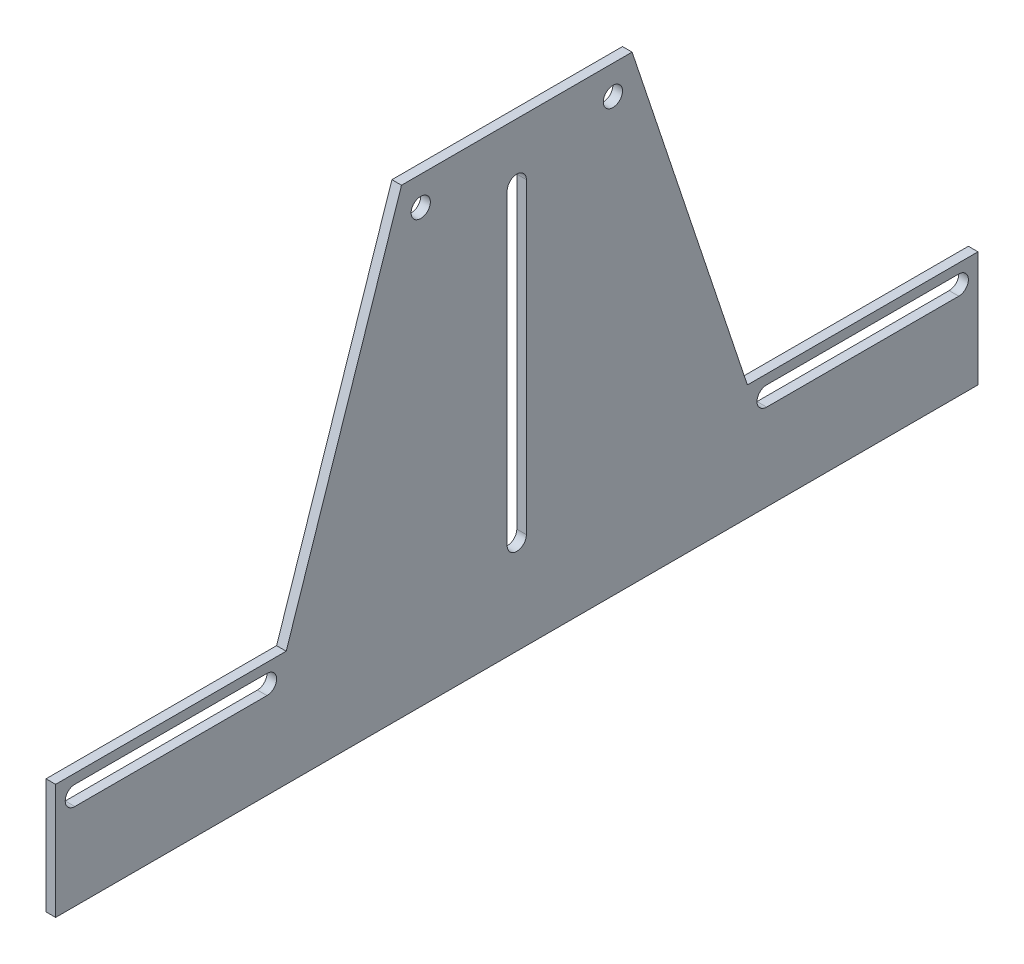
from build123d import *

# Parameters (mm, degrees)
SKETCH1_R           = 6.35
BOSS_EXTRUDE1_DEPTH = 6.35


with BuildPart() as part:
    # Sketch1 → Boss-Extrude1 (new body)
    with BuildSketch(Plane(origin=(0, 0, 0), x_dir=(0, 0, -1), z_dir=(1, 0, 0))):
        Polygon((304.8, 0), (-304.8, 0), (-304.8, 76.2), (-152.4, 76.2), (-76.2, 304.8), (76.2, 304.8), (152.4, 76.2), (304.8, 76.2), align=None)
        with Locations((-63.5, 285.75)):
            Circle(SKETCH1_R, mode=Mode.SUBTRACT)
        with Locations(Location((63.5, 285.75, 0), (0, 0, 180))):
            Circle(SKETCH1_R, mode=Mode.SUBTRACT)
        with BuildLine():
            Line((-292.1, 69.85), (-165.1, 69.85))
            ThreePointArc((-165.1, 69.85), (-158.75, 63.5), (-165.1, 57.15))
            Line((-165.1, 57.15), (-292.1, 57.15))
            ThreePointArc((-292.1, 57.15), (-298.45, 63.5), (-292.1, 69.85))
        make_face(mode=Mode.SUBTRACT)
        with BuildLine():
            Line((292.1, 69.85), (165.1, 69.85))
            ThreePointArc((165.1, 69.85), (158.75, 63.5), (165.1, 57.15))
            Line((165.1, 57.15), (292.1, 57.15))
            ThreePointArc((292.1, 57.15), (298.45, 63.5), (292.1, 69.85))
        make_face(mode=Mode.SUBTRACT)
        with BuildLine():
            Line((6.35, 266.7), (6.35, 63.5))
            ThreePointArc((6.35, 63.5), (0, 57.15), (-6.35, 63.5))
            Line((-6.35, 63.5), (-6.35, 266.7))
            ThreePointArc((-6.35, 266.7), (0, 273.05), (6.35, 266.7))
        make_face(mode=Mode.SUBTRACT)
    extrude(amount=BOSS_EXTRUDE1_DEPTH)


solid = part.part
